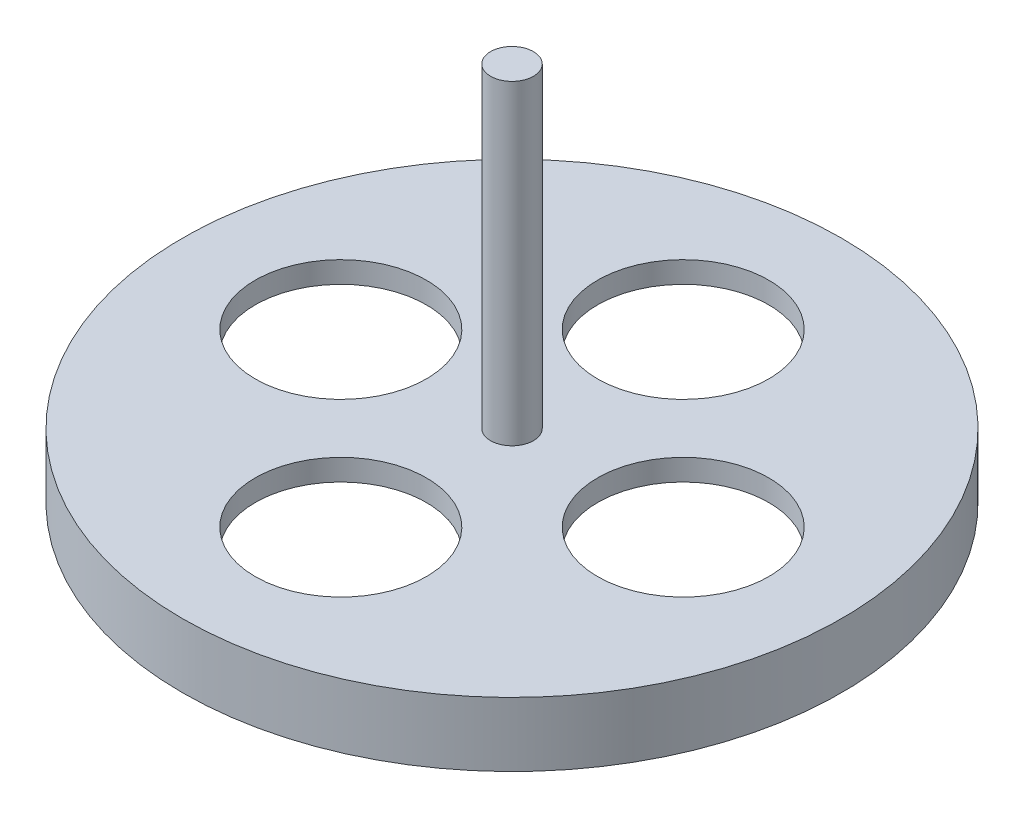
from build123d import *

# Parameters (mm, degrees)
SKETCH1_R           = 48.895
SKETCH1_R_2         = 45.72
BOSS_EXTRUDE1_DEPTH = 6.35
SKETCH2_R           = 48.895
SKETCH2_R_2         = 12.7
BOSS_EXTRUDE2_DEPTH = 3.175
SKETCH3_R           = 3.175
BOSS_EXTRUDE3_DEPTH = 46.825


with BuildPart() as part:
    # Sketch1 → Boss-Extrude1 (new body)
    with BuildSketch(Plane(origin=(0, 0, 0), x_dir=(1, 0, 0), z_dir=(0, 1, 0))):
        with Locations(Location((0, 0, 0), (0, 0, 270))):
            Circle(SKETCH1_R)
        with Locations(Location((0, 0, 0), (0, 0, 270))):
            Circle(SKETCH1_R_2, mode=Mode.SUBTRACT)
    extrude(amount=BOSS_EXTRUDE1_DEPTH)

    # Sketch2 → Boss-Extrude2 (add)
    with BuildSketch(Plane(origin=(0, 6.35, 0), x_dir=(1, 0, 0), z_dir=(0, 1, 0))):
        with Locations(Location((0, 0, 0), (0, 0, 270))):
            Circle(SKETCH2_R)
        with Locations(Location((0, 25.4, 0), (0, 0, 270))):
            Circle(SKETCH2_R_2, mode=Mode.SUBTRACT)
        with Locations(Location((25.4, 0, 0), (0, 0, 270))):
            Circle(SKETCH2_R_2, mode=Mode.SUBTRACT)
        with Locations(Location((0, -25.4, 0), (0, 0, 270))):
            Circle(SKETCH2_R_2, mode=Mode.SUBTRACT)
        with Locations(Location((-25.4, 0, 0), (0, 0, 270))):
            Circle(SKETCH2_R_2, mode=Mode.SUBTRACT)
    extrude(amount=BOSS_EXTRUDE2_DEPTH)

    # Sketch3 → Boss-Extrude3 (add)
    with BuildSketch(Plane(origin=(0, 9.525, 0), x_dir=(1, 0, 0), z_dir=(0, 1, 0))):
        with Locations(Location((0, 0, 0), (0, 0, 270))):
            Circle(SKETCH3_R)
    extrude(amount=BOSS_EXTRUDE3_DEPTH)


solid = part.part
